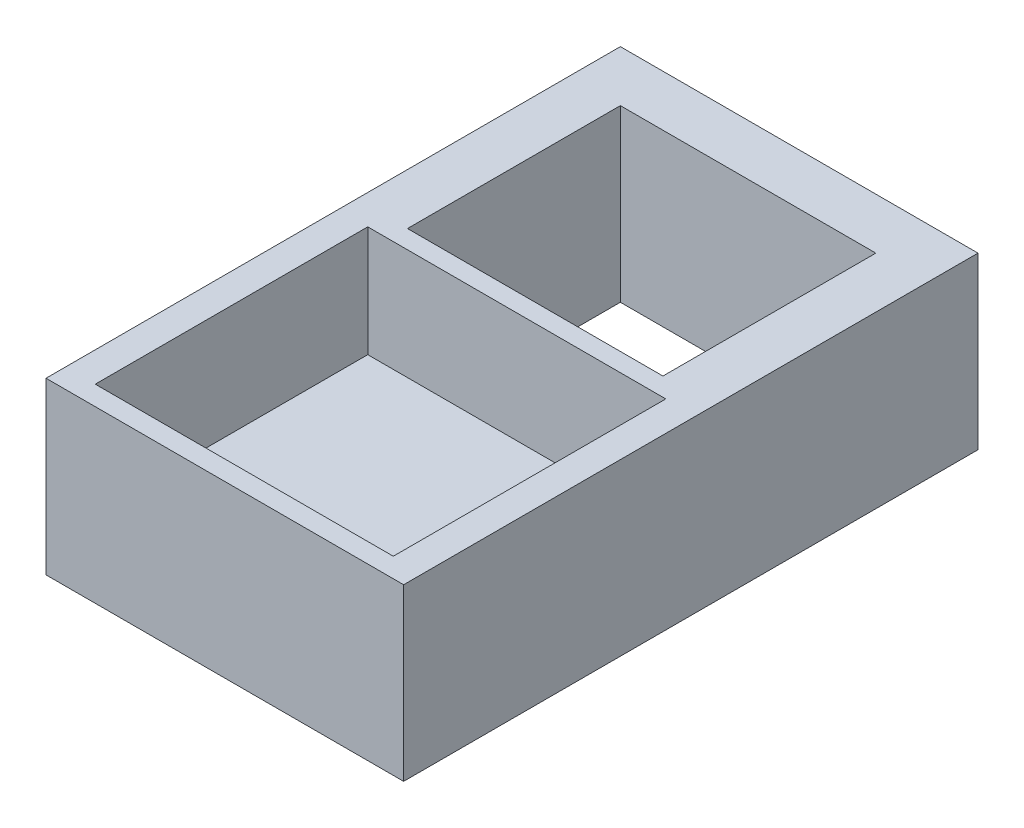
from build123d import *

# Parameters (mm, degrees)
SKETCH1_W           = 12.05
SKETCH1_H           = 22.45
BOSS_EXTRUDE2_DEPTH = 20
SKETCH6_W           = 35.864128229
SKETCH6_H           = 30.191250037
BOSS_EXTRUDE3_DEPTH = 20
SKETCH7_W           = 35
SKETCH7_H           = 32
CUT_EXTRUDE3_DEPTH  = 13


with BuildPart() as part:
    # Sketch1 → Boss-Extrude2 (new body)
    with BuildSketch(Plane(origin=(0, 0, 0), x_dir=(1, 0, 0), z_dir=(0, 1, 0))):
        Polygon((-39.417705009, -78.511923184), (-39.417705009, -39.511923184), (-18.417705009, -39.511923184), (2.582294991, -39.511923184), (2.582294991, -78.511923184), (2.582294991, -106.961923184), (-18.417705009, -106.961923184), (-39.417705009, -106.961923184), align=None)
        with Locations((-27.392705009, -89.736923184)):
            Rectangle(SKETCH1_W, SKETCH1_H, mode=Mode.SUBTRACT)
        Polygon((-33.417705009, -70.511923184), (-33.417705009, -45.511923184), (-18.417705009, -45.511923184), (-3.417705009, -45.511923184), (-3.417705009, -70.511923184), align=None, mode=Mode.SUBTRACT)
        with Locations((-9.442705009, -89.736923184)):
            Rectangle(SKETCH1_W, SKETCH1_H, mode=Mode.SUBTRACT)
    extrude(amount=BOSS_EXTRUDE2_DEPTH)

    # Sketch6 → Boss-Extrude3 (add)
    with BuildSketch(Plane(origin=(0, 20, 0), x_dir=(1, 0, 0), z_dir=(0, 1, 0))):
        with Locations((-18.754231682, -88.861375831)):
            Rectangle(SKETCH6_W, SKETCH6_H)
    extrude(amount=-BOSS_EXTRUDE3_DEPTH)

    # Sketch7 → Cut-Extrude3 (cut)
    with BuildSketch(Plane(origin=(0, 20, 0), x_dir=(1, 0, 0), z_dir=(0, 1, 0))):
        with Locations((-18.421350721, -88.672765983)):
            Rectangle(SKETCH7_W, SKETCH7_H)
    extrude(amount=-CUT_EXTRUDE3_DEPTH, mode=Mode.SUBTRACT)


solid = part.part
